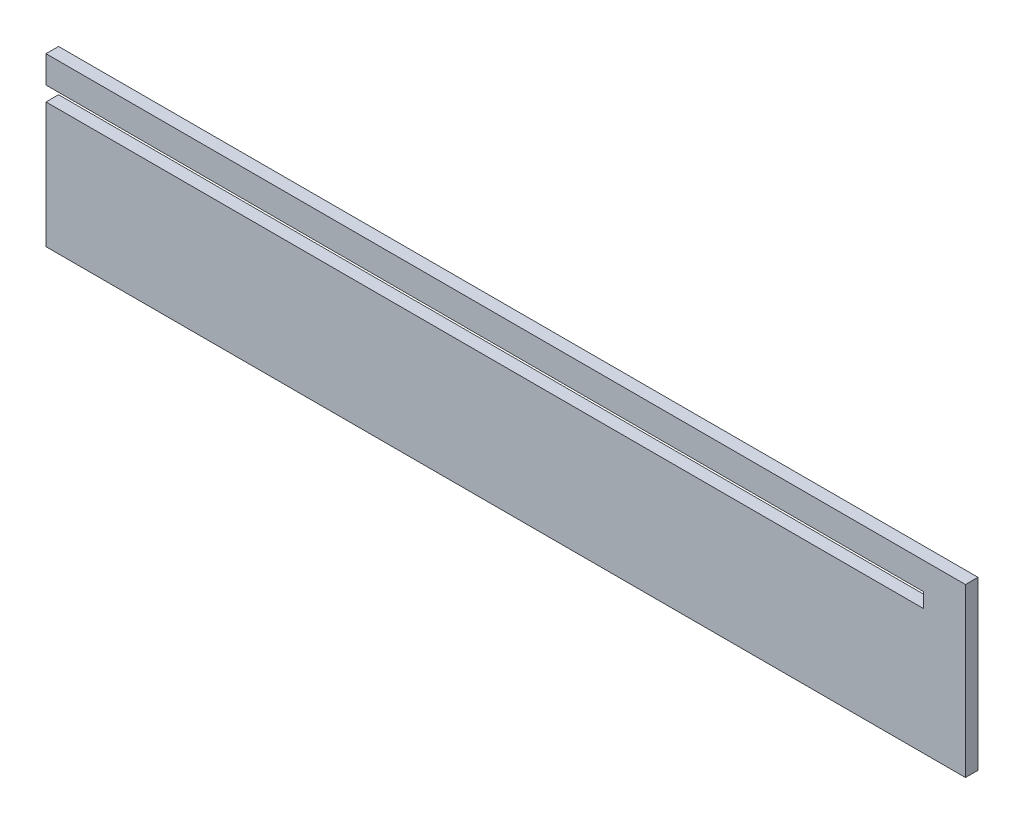
from build123d import *

# Parameters (mm, degrees)
P_IDAT_VYSUNUT_M1_DEPTH = 3


with BuildPart() as part:
    # Skica1 → Přidat vysunutím1 (new body)
    with BuildSketch(Plane.XY):
        Polygon((0, 30), (0, 0), (220, 0), (220, 40), (0, 40), (0, 33.5), (210, 33.5), (210, 30), align=None)
    extrude(amount=P_IDAT_VYSUNUT_M1_DEPTH)


solid = part.part
